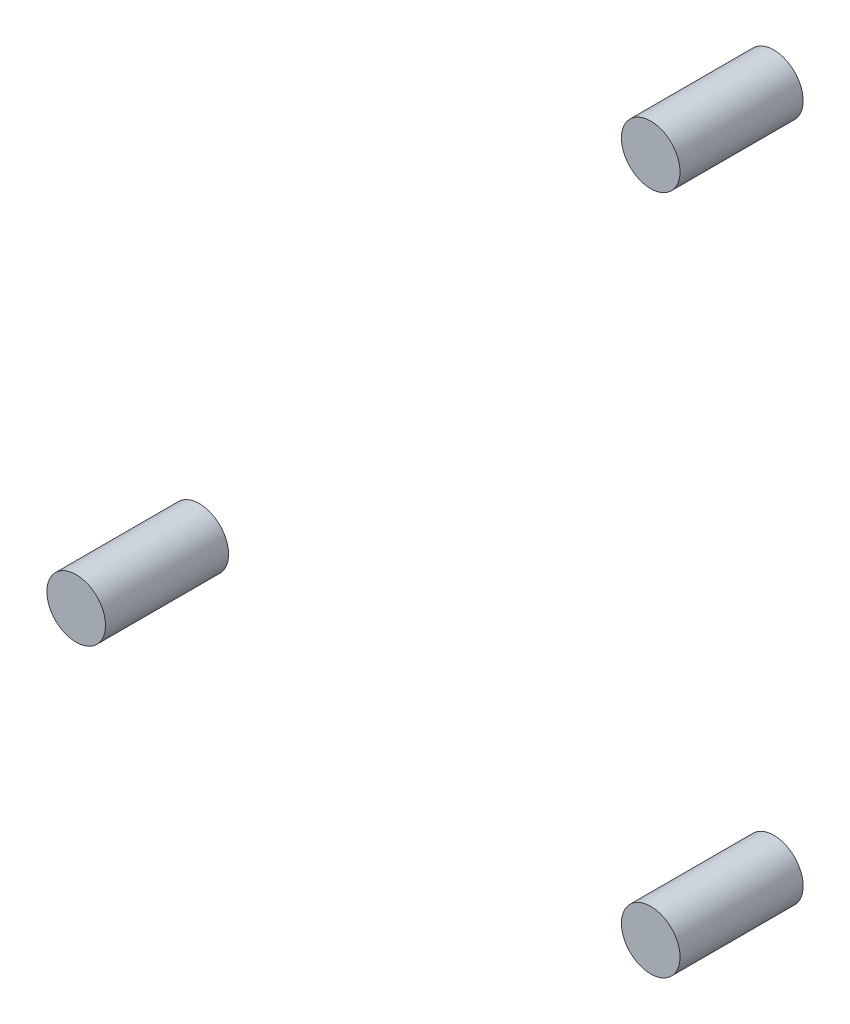
from build123d import *

# Parameters (mm, degrees)
SKETCH1_R             = 2.5
BOSS_EXTRUDE1_DEPTH   = 10.500000794
BOSS_EXTRUDE1_2_DEPTH = 10.500000794
BOSS_EXTRUDE1_3_DEPTH = 10.500000794


with BuildPart() as part:
    # Sketch1 → Boss-Extrude1 (new body)
    with BuildSketch(Plane.XY):
        with Locations(Location((37.395999908, 192.908996582, 0), (0, 0, 270))):
            Circle(SKETCH1_R)
    extrude(amount=BOSS_EXTRUDE1_DEPTH)


with BuildPart() as body_2:
    # Sketch1 → Boss-Extrude1 2 (new body)
    with BuildSketch(Plane.XY):
        with Locations(Location((86.395999908, 192.908996582, 0), (0, 0, 270))):
            Circle(SKETCH1_R)
    extrude(amount=BOSS_EXTRUDE1_2_DEPTH)


with BuildPart() as body_3:
    # Sketch1 → Boss-Extrude1 3 (new body)
    with BuildSketch(Plane.XY):
        with Locations(Location((86.395999908, 250.908996582, 0), (0, 0, 270))):
            Circle(SKETCH1_R)
    extrude(amount=BOSS_EXTRUDE1_3_DEPTH)


solid = Compound([part.part, body_2.part, body_3.part])
